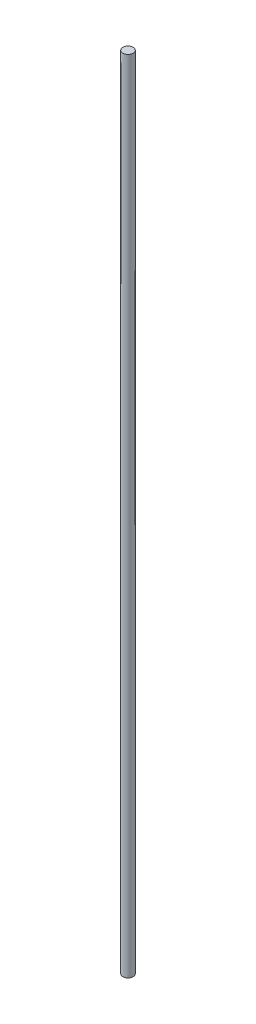
from build123d import *

# Parameters (mm, degrees)
SKETCH_1_R      = 1.2
EXTRUDE_1_DEPTH = 186


with BuildPart() as part:
    # 草图1 → 凸台-拉伸1 (new body)
    with BuildSketch(Plane(origin=(0, 0, 0), x_dir=(1, 0, 0), z_dir=(0, 1, 0))):
        with Locations(Location((0, 0, 0), (0, 0, 90))):
            Circle(SKETCH_1_R)
    extrude(amount=EXTRUDE_1_DEPTH)


solid = part.part
